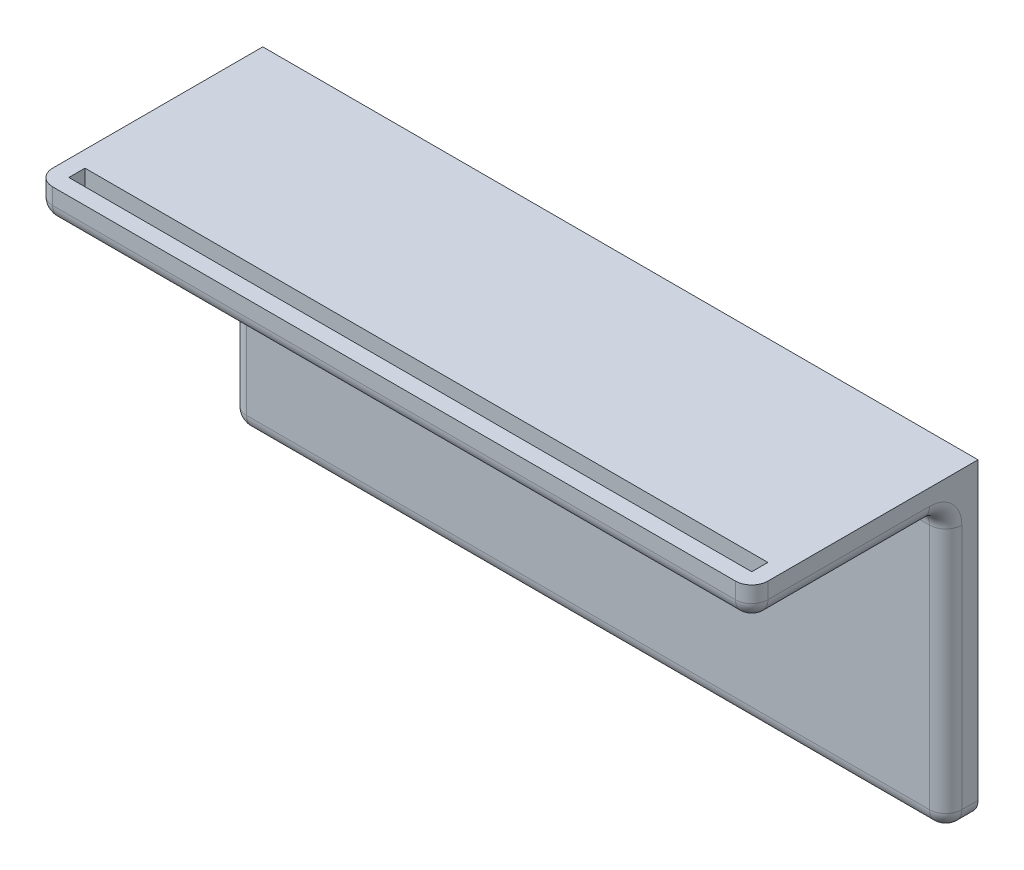
from build123d import *

# Parameters (mm, degrees)
SKETCH1_W           = 38.5
SKETCH1_H           = 88.5
BOSS_EXTRUDE1_DEPTH = 28
SKETCH2_W           = 34.5
SKETCH2_H           = 24
CUT_EXTRUDE1_DEPTH  = 88.5
FILLET1_R           = 2
FILLET2_R           = 2
FILLET3_R           = 2
FILLET4_R           = 2
FILLET5_R           = 2
SKETCH3_W           = 84.5
SKETCH3_H           = 2
CUT_EXTRUDE2_DEPTH  = 2


with BuildPart() as part:
    # Sketch1 → Boss-Extrude1 (new body)
    with BuildSketch(Plane(origin=(0, 0, 0), x_dir=(0, 1, 0), z_dir=(0, 0, 1))):
        Rectangle(SKETCH1_W, SKETCH1_H)
    extrude(amount=BOSS_EXTRUDE1_DEPTH)

    # Sketch2 → Cut-Extrude1 (cut)
    with BuildSketch(Plane.YZ.offset(44.25)):
        with Locations((-2, 16)):
            Rectangle(SKETCH2_W, SKETCH2_H)
    extrude(amount=-CUT_EXTRUDE1_DEPTH, mode=Mode.SUBTRACT)

    # Fillet1
    fillet1_edges = [part.edges().sort_by_distance(p)[0] for p in [
        (0, 15.25, 4),
    ]]
    fillet(fillet1_edges, radius=FILLET1_R)

    # Fillet2
    fillet2_edges = [part.edges().sort_by_distance(p)[0] for p in [
        (0, 15.25, 28),
    ]]
    fillet(fillet2_edges, radius=FILLET2_R)

    # Fillet3
    fillet3_edges = [part.edges().sort_by_distance(p)[0] for p in [
        (0, -19.25, 4),
    ]]
    fillet(fillet3_edges, radius=FILLET3_R)

    # Fillet4
    fillet4_edges = [part.edges().sort_by_distance(p)[0] for p in [
        (44.25, 15.25, 16),
        (44.25, 14.664213562, 4.585786438),
        (44.25, 18.25, 28),
        (44.25, 15.835786438, 27.414213562),
        (44.25, -2, 4),
        (44.25, -19.25, 1),
        (44.25, -18.664213562, 3.414213562),
    ]]
    fillet(fillet4_edges, radius=FILLET4_R)

    # Fillet5
    fillet5_edges = [part.edges().sort_by_distance(p)[0] for p in [
        (-44.25, 15.25, 16),
        (-44.25, 14.664213562, 4.585786438),
        (-44.25, 15.835786438, 27.414213562),
        (-44.25, -2, 4),
        (-44.25, -19.25, 1),
        (-44.25, -18.664213562, 3.414213562),
        (-44.25, 18.25, 28),
    ]]
    fillet(fillet5_edges, radius=FILLET5_R)

    # Sketch3 → Cut-Extrude2 (cut)
    with BuildSketch(Plane(origin=(0, 19.25, 0), x_dir=(-1, 0, 0), z_dir=(0, 1, 0))):
        with Locations((0, 25)):
            Rectangle(SKETCH3_W, SKETCH3_H)
    extrude(amount=-CUT_EXTRUDE2_DEPTH, mode=Mode.SUBTRACT)


solid = part.part
